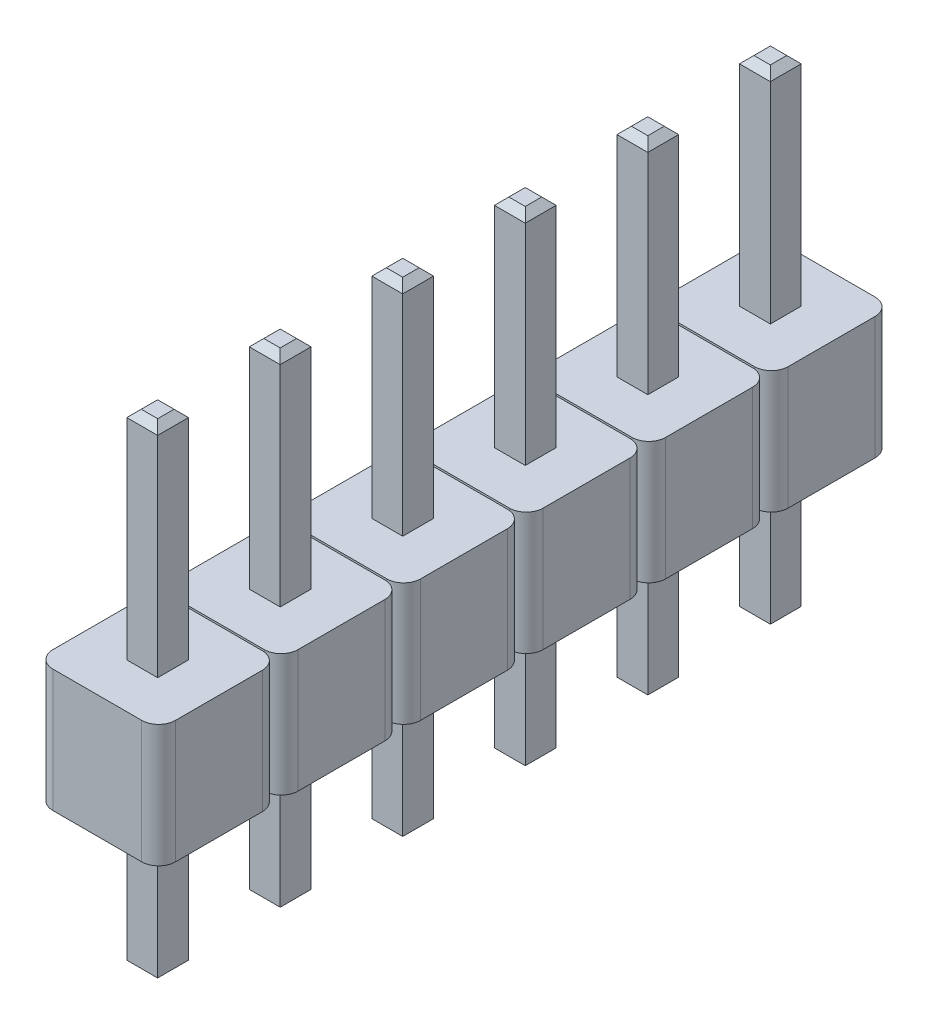
from build123d import *

# Parameters (mm, degrees)
SKETCH1_W           = 0.64
SKETCH1_H           = 0.64
BOSS_EXTRUDE1_DEPTH = 10.04
CHAMFER1_SIZE       = 0.15
BOSS_EXTRUDE2_DEPTH = 2.54
LPATTERN2_COUNT     = 6
LPATTERN2_PITCH     = 2.54


with BuildPart() as part:
    # Sketch1 → Boss-Extrude1 (new body)
    with BuildSketch(Plane(origin=(0, 0, 0), x_dir=(1, 0, 0), z_dir=(0, 1, 0))):
        with Locations((0.32, 0.32)):
            Rectangle(SKETCH1_W, SKETCH1_H)
    extrude(amount=BOSS_EXTRUDE1_DEPTH)

    # Chamfer1
    chamfer1_edges = [part.edges().sort_by_distance(p)[0] for p in [
        (0.32, 0, 0),
        (0.64, 0, -0.32),
        (0.32, 0, -0.64),
        (0, 0, -0.32),
        (0.32, 10.04, -0.64),
        (0.64, 10.04, -0.32),
        (0.32, 10.04, 0),
        (0, 10.04, -0.32),
    ]]
    chamfer(chamfer1_edges, length=CHAMFER1_SIZE)

    # Sketch3 → Boss-Extrude2 (add)
    with BuildSketch(Plane(origin=(0, 5.54, 0), x_dir=(1, 0, 0), z_dir=(0, 1, 0))):
        with BuildLine():
            Line((-0.6, -0.93), (1.24, -0.93))
            ThreePointArc((1.24, -0.93), (1.487487373, -0.827487373), (1.59, -0.58))
            Line((1.59, -0.58), (1.59, 1.22))
            ThreePointArc((1.59, 1.22), (1.487487373, 1.467487373), (1.24, 1.57))
            Line((1.24, 1.57), (-0.6, 1.57))
            ThreePointArc((-0.6, 1.57), (-0.847487373, 1.467487373), (-0.95, 1.22))
            Line((-0.95, 1.22), (-0.95, -0.58))
            ThreePointArc((-0.95, -0.58), (-0.847487373, -0.827487373), (-0.6, -0.93))
        make_face()
    extrude(amount=-BOSS_EXTRUDE2_DEPTH)


with BuildPart() as lpattern2_1:
    # LPattern2: pattern copy
    add(part.part.moved(Location(Vector(0, 0, -1) * (1 * LPATTERN2_PITCH))))


with BuildPart() as lpattern2_2:
    # LPattern2: pattern copy
    add(part.part.moved(Location(Vector(0, 0, -1) * (2 * LPATTERN2_PITCH))))


with BuildPart() as lpattern2_3:
    # LPattern2: pattern copy
    add(part.part.moved(Location(Vector(0, 0, -1) * (3 * LPATTERN2_PITCH))))


with BuildPart() as lpattern2_4:
    # LPattern2: pattern copy
    add(part.part.moved(Location(Vector(0, 0, -1) * (4 * LPATTERN2_PITCH))))


with BuildPart() as lpattern2_5:
    # LPattern2: pattern copy
    add(part.part.moved(Location(Vector(0, 0, -1) * (5 * LPATTERN2_PITCH))))


solid = Compound([part.part, lpattern2_1.part, lpattern2_2.part, lpattern2_3.part, lpattern2_4.part, lpattern2_5.part])
